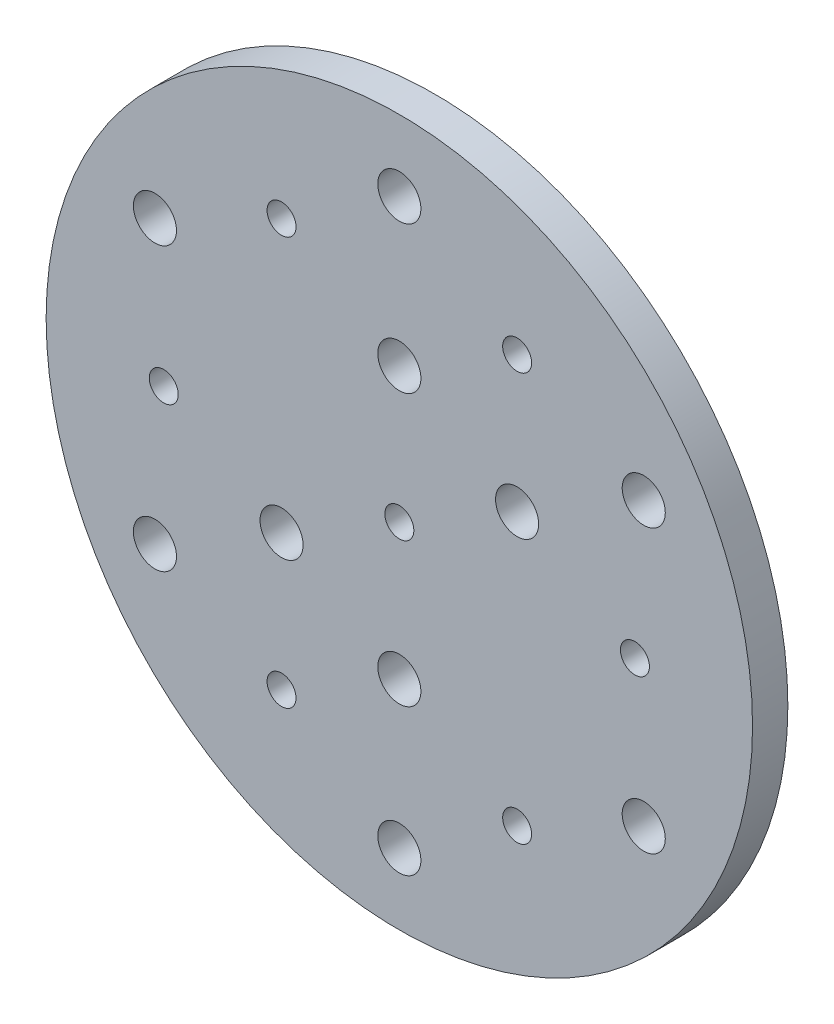
from build123d import *

# Parameters (mm, degrees)
ESQUISSE1_R        = 50
ESQUISSE1_R_2      = 3.05
ESQUISSE1_R_3      = 2.05
BOSS_EXTRU_1_DEPTH = 5


with BuildPart() as part:
    # Esquisse1 → Boss.-Extru.1 (new body)
    with BuildSketch(Plane.XY):
        Circle(ESQUISSE1_R)
        with Locations((-34.597845014, 19.975075133)):
            Circle(ESQUISSE1_R_2, mode=Mode.SUBTRACT)
        with Locations((0, 39.950150265)):
            Circle(ESQUISSE1_R_2, mode=Mode.SUBTRACT)
        with Locations((34.597845014, 19.975075133)):
            Circle(ESQUISSE1_R_2, mode=Mode.SUBTRACT)
        with Locations((34.597845014, -19.975075132)):
            Circle(ESQUISSE1_R_2, mode=Mode.SUBTRACT)
        with Locations((0, -39.950150265)):
            Circle(ESQUISSE1_R_2, mode=Mode.SUBTRACT)
        with Locations((-34.597845014, -19.975075133)):
            Circle(ESQUISSE1_R_2, mode=Mode.SUBTRACT)
        with Locations((0, 19.165334425)):
            Circle(ESQUISSE1_R_2, mode=Mode.SUBTRACT)
        with Locations((0, -19.232757636)):
            Circle(ESQUISSE1_R_2, mode=Mode.SUBTRACT)
        with Locations((-33.35, 0)):
            Circle(ESQUISSE1_R_3, mode=Mode.SUBTRACT)
        with Locations((-16.675, 28.881947216)):
            Circle(ESQUISSE1_R_3, mode=Mode.SUBTRACT)
        with Locations((16.675, 28.881947216)):
            Circle(ESQUISSE1_R_3, mode=Mode.SUBTRACT)
        with Locations((33.35, 0)):
            Circle(ESQUISSE1_R_3, mode=Mode.SUBTRACT)
        with Locations((16.675, -28.881947216)):
            Circle(ESQUISSE1_R_3, mode=Mode.SUBTRACT)
        with Locations((-16.675, -28.881947216)):
            Circle(ESQUISSE1_R_3, mode=Mode.SUBTRACT)
        Circle(ESQUISSE1_R_3, mode=Mode.SUBTRACT)
        with Locations((-16.671397033, -9.625235564)):
            Circle(ESQUISSE1_R_2, mode=Mode.SUBTRACT)
        with Locations((16.669571796, 9.624181764)):
            Circle(ESQUISSE1_R_2, mode=Mode.SUBTRACT)
    extrude(amount=BOSS_EXTRU_1_DEPTH)


solid = part.part
